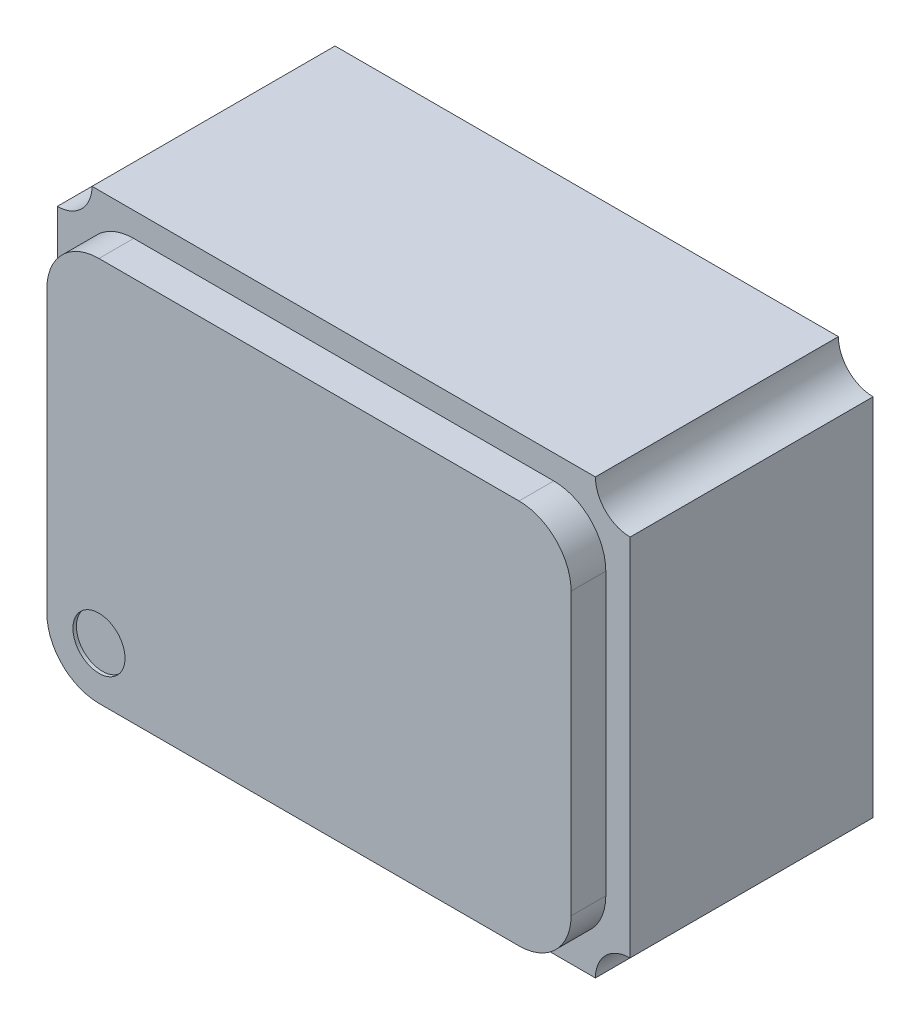
from build123d import *

# Parameters (mm, degrees)
SKETCH1_W           = 1.65
SKETCH1_H           = 1.25
BOSS_EXTRUDE1_DEPTH = 0.7
SKETCH2_W           = 1.51
SKETCH2_H           = 1.11
BOSS_EXTRUDE2_DEPTH = 0.1
FILLET1_R           = 0.15
SKETCH3_R           = 0.1
CUT_EXTRUDE1_DEPTH  = 2.2494999
SKETCH4_R           = 0.075
CUT_EXTRUDE2_DEPTH  = 0.01


with BuildPart() as part:
    # Sketch1 → Boss-Extrude1 (new body)
    with BuildSketch(Plane.XY):
        Rectangle(SKETCH1_W, SKETCH1_H)
    extrude(amount=BOSS_EXTRUDE1_DEPTH)

    # Sketch2 → Boss-Extrude2 (add)
    with BuildSketch(Plane.XY.offset(0.7)):
        Rectangle(SKETCH2_W, SKETCH2_H)
    extrude(amount=BOSS_EXTRUDE2_DEPTH)

    # Fillet1
    fillet1_edges = [part.edges().sort_by_distance(p)[0] for p in [
        (0.755, -0.555, 0.75),
        (0.755, 0.555, 0.75),
        (-0.755, 0.555, 0.75),
        (-0.755, -0.555, 0.75),
    ]]
    fillet(fillet1_edges, radius=FILLET1_R)

    # Sketch3 → Cut-Extrude1 (cut, through all)
    with BuildSketch(Plane.XY.offset(0.7)):
        with Locations((-0.825, 0.625)):
            Circle(SKETCH3_R)
        with Locations((0.825, 0.625)):
            Circle(SKETCH3_R)
        with Locations((0.825, -0.625)):
            Circle(SKETCH3_R)
        with Locations((-0.825, -0.625)):
            Circle(SKETCH3_R)
    extrude(amount=-CUT_EXTRUDE1_DEPTH, mode=Mode.SUBTRACT)

    # Sketch4 → Cut-Extrude2 (cut)
    with BuildSketch(Plane.XY.offset(0.8)):
        with Locations((-0.605, -0.405)):
            Circle(SKETCH4_R)
    extrude(amount=-CUT_EXTRUDE2_DEPTH, mode=Mode.SUBTRACT)


solid = part.part
